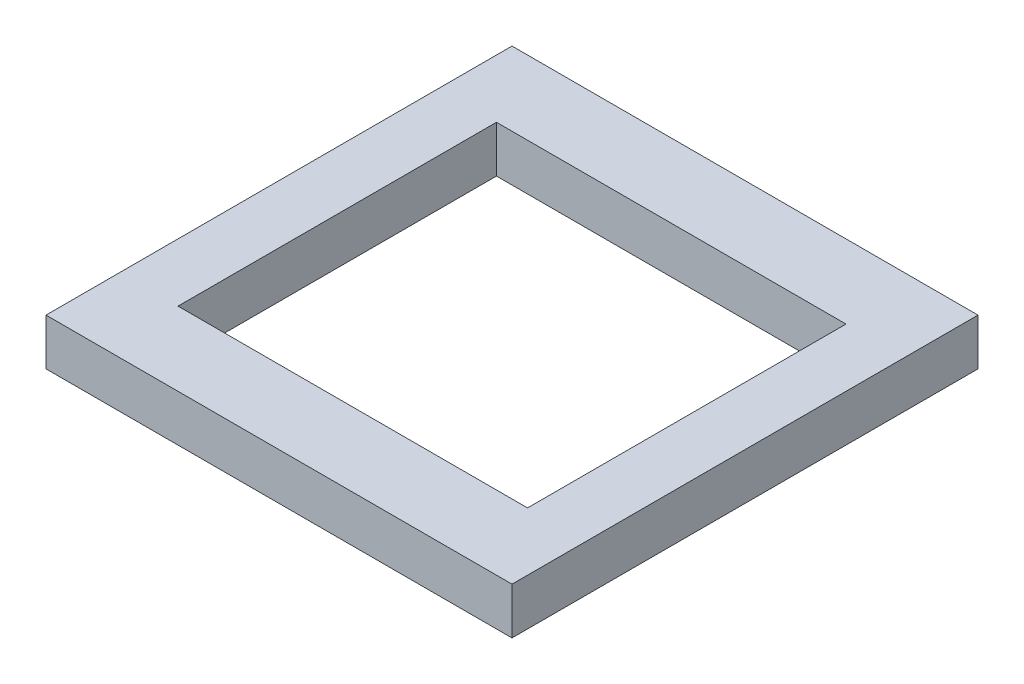
from build123d import *

# Parameters (mm, degrees)
SKETCH1_W           = 60
SKETCH1_H           = 60
SKETCH1_W_2         = 45
SKETCH1_H_2         = 41
BOSS_EXTRUDE1_DEPTH = 6


with BuildPart() as part:
    # Sketch1 → Boss-Extrude1 (new body)
    with BuildSketch(Plane(origin=(0, 0, 0), x_dir=(1, 0, 0), z_dir=(0, 1, 0))):
        Rectangle(SKETCH1_W, SKETCH1_H)
        Rectangle(SKETCH1_W_2, SKETCH1_H_2, mode=Mode.SUBTRACT)
    extrude(amount=BOSS_EXTRUDE1_DEPTH)


solid = part.part
